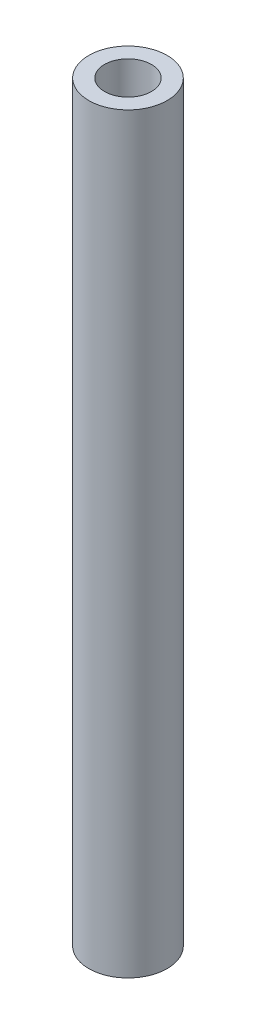
from build123d import *

# Parameters (mm, degrees)
SKETCH_1_R      = 2.5
SKETCH_1_R_2    = 1.5
EXTRUDE_1_DEPTH = 48


with BuildPart() as part:
    # 草图1 → 凸台-拉伸1 (new body)
    with BuildSketch(Plane(origin=(0, 0, 0), x_dir=(1, 0, 0), z_dir=(0, 1, 0))):
        with Locations(Location((0, 0, 0), (0, 0, 270))):
            Circle(SKETCH_1_R)
        with Locations(Location((0, 0, 0), (0, 0, 270))):
            Circle(SKETCH_1_R_2, mode=Mode.SUBTRACT)
    extrude(amount=EXTRUDE_1_DEPTH)


solid = part.part
